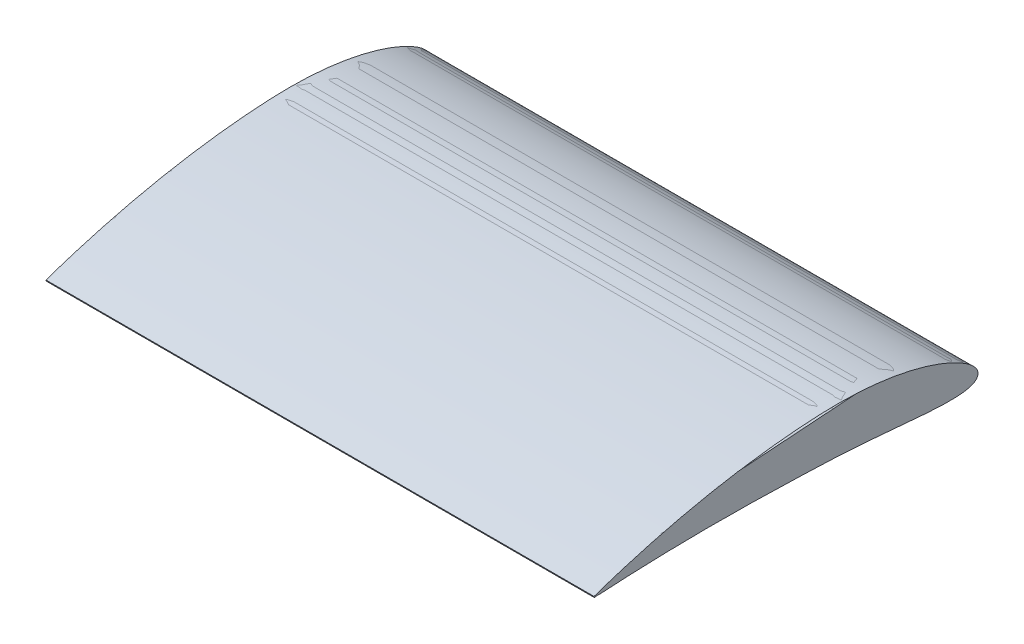
from build123d import *

# Parameters (mm, degrees)
BOSS_EXTRUDE1_DEPTH      = 254
BOSS_EXTRUDE1_DEPTH_BACK = 254


with BuildPart() as part:
    # Sketch1 → Boss-Extrude1 (new, two sides: drawn at the far end of the back side and taken through both)
    with BuildSketch(Plane(origin=(0, 0, 0), x_dir=(0, 0, -1), z_dir=(1, 0, 0)).offset(-BOSS_EXTRUDE1_DEPTH_BACK)):
        with BuildLine():
            Line((-354.886743617, -0.043132144), (-354.99149892, 0.476454159))
            add(Edge.make_bspline(
                [(-354.99149892, 0.476454159), (-347.783593071, 2.959720022), (-333.311697469, 7.76743875), (-304.078052973, 16.464991966), (-267.096515494, 25.774786648), (-229.639462396, 32.944545613), (-199.450230249, 37.301190717), (-176.714275569, 39.827183694), (-153.906158518, 41.58647891), (-131.03977612, 42.479842921), (-108.154229955, 41.863767742), (-89.168120213, 39.979475533), (-74.098856377, 37.594417698), (-62.881435173, 35.331879377), (-51.7773445, 32.562006126), (-40.824113666, 29.240494899), (-31.867581604, 25.954413067), (-24.850887862, 22.951954032), (-19.685642534, 20.484382266), (-14.645467459, 17.767522296), (-9.77578942, 14.742035882), (-5.946772155, 11.874879811), (-3.140632771, 9.269412602), (-1.24439325, 7.100121216), (0.080172615, 5.059059621), (0.734728016, 3.225404373), (0.959702576, 1.749644514), (0.852938138, 0.273348057), (0.143098613, -1.559511436), (-1.577222389, -3.417578203), (-4.142703198, -4.776298794), (-6.885121223, -5.694029747), (-9.681876117, -6.330501065), (-13.458760778, -6.919755633), (-18.220322024, -7.307987073), (-23.94144297, -7.464251794), (-29.662456321, -7.409321836), (-35.379234273, -7.211608771), (-41.090605222, -6.912227315), (-48.699082932, -6.414379812), (-58.199146289, -5.657863194), (-69.590216516, -4.65595538), (-80.978589908, -3.630054837), (-92.368874257, -2.627816782), (-107.56313892, -1.375441372), (-126.573365315, -0.048864739), (-145.613201917, 0.757519293), (-160.850436225, 1.274697119), (-176.087168981, 1.801353096), (-195.136294848, 2.345387362), (-218.000758012, 2.779371126), (-237.05701774, 2.925569666), (-252.302341579, 2.896860798), (-263.73597927, 2.802520029), (-275.168693373, 2.637956293), (-286.600178358, 2.391728354), (-296.124627961, 2.123723762), (-303.742775876, 1.877302738), (-309.456624125, 1.672578754), (-315.170675094, 1.447330006), (-320.881449306, 1.206811952), (-326.586197896, 0.954928725), (-331.352247356, 0.714636978), (-335.168021523, 0.511580202), (-338.020999346, 0.36724993), (-340.852436227, 0.246984365), (-343.684829351, 0.118397327), (-346.099213672, -0.068340914), (-348.057709576, -0.249421829), (-349.49515544, -0.343114156), (-350.641754644, -0.345792204), (-351.509080841, -0.291364997), (-352.169529456, -0.275148661), (-352.878616179, -0.32484418), (-353.534718925, -0.45936157), (-354.133565705, -0.643391605), (-354.471117086, -0.699431405), (-354.718790465, -0.620573956), (-354.877800433, -0.392167923), (-354.878804645, -0.178279335), (-354.886743617, -0.043132144)],
                knots=[-0.000119616, -0.000119616, -0.000119616, -0.000119616, 0.031133862, 0.062387339, 0.124894294, 0.187401249, 0.218654727, 0.249908204, 0.281161682, 0.312415159, 0.343668637, 0.374922115, 0.390548853, 0.406175592, 0.421802331, 0.43742907, 0.453055808, 0.460869178, 0.468682547, 0.476495916, 0.484309286, 0.492122655, 0.49602934, 0.499936025, 0.503842709, 0.505796052, 0.507749394, 0.509702736, 0.511656079, 0.515562763, 0.519469448, 0.523376133, 0.527282817, 0.531189502, 0.539002872, 0.546816241, 0.55462961, 0.56244298, 0.570256349, 0.578069718, 0.593696457, 0.609323196, 0.624949935, 0.640576673, 0.656203412, 0.68745689, 0.718710367, 0.734337106, 0.749963845, 0.781217322, 0.8124708, 0.843724277, 0.859351016, 0.874977755, 0.890604494, 0.906231232, 0.921857971, 0.929671341, 0.93748471, 0.945298079, 0.953111449, 0.960924818, 0.968738187, 0.972644872, 0.976551557, 0.980458242, 0.984364926, 0.988271611, 0.990224953, 0.992178296, 0.994131638, 0.995108309, 0.99608498, 0.997061652, 0.998038323, 0.998526658, 0.999014994, 0.999259162, 0.999503329, 0.999991665, 0.999991665, 0.999991665, 0.999991665], degree=3))
        make_face()
        with BuildLine():
            Line((-354.787327228, -0.030257196), (-354.876173011, 0.410417887))
            add(Edge.make_bspline(
                [(-354.876173011, 0.410417887), (-354.559877309, 0.519388), (-353.29965963, 0.95355787), (-350.47872665, 1.927095868), (-345.800950265, 3.497798274), (-336.024074692, 6.721551148), (-319.654473712, 11.798891927), (-300.598349456, 17.130600639), (-282.422876264, 21.724272526), (-261.175777938, 26.651569731), (-238.622276389, 31.145528798), (-208.774809213, 36.004755717), (-183.96165787, 39.090454058), (-158.902335219, 41.113212891), (-140.096691022, 42.111376668), (-121.516747473, 42.228858195), (-103.422167262, 41.321050632), (-86.188408528, 39.478676181), (-70.043450957, 36.810480574), (-55.199760436, 33.432905997), (-41.843390777, 29.510854383), (-30.130463623, 25.220125297), (-20.187014188, 20.73431935), (-12.107203154, 16.226289935), (-5.926897661, 11.855341958), (-1.679224073, 7.716499794), (0.765838065, 3.796757813), (0.987487677, -0.148325216), (-1.35108726, -3.308943186), (-5.450780885, -5.288085739), (-11.087315968, -6.587464624), (-18.34911979, -7.268527656), (-27.163826626, -7.404874951), (-37.447057223, -7.053797092), (-49.083078017, -6.301866785), (-61.95239395, -5.238034817), (-75.929862643, -3.983911698), (-96.406736552, -2.153555858), (-117.937239158, -0.458414508), (-140.484776897, 0.674535203), (-158.296467959, 1.286744043), (-176.48388462, 1.917893193), (-200.671973719, 2.586246563), (-224.541124114, 2.979106232), (-247.830237405, 3.028480659), (-264.337268621, 2.907447598), (-279.933149694, 2.656365926), (-294.437996632, 2.282890374), (-307.681856469, 1.852126627), (-319.513378006, 1.371074809), (-329.767358246, 0.912902227), (-338.388880463, 0.426846955), (-345.076973543, 0.191518705), (-350.227621538, -0.406394891), (-352.780150329, -0.035387827), (-354.744619464, -0.75811662), (-354.777220059, -0.20251155), (-354.787327228, -0.030257196)],
                knots=[0, 0, 0, 0, 0.001371577, 0.005464776, 0.012234802, 0.021601969, 0.04767125, 0.082496261, 0.102719149, 0.124527079, 0.171912573, 0.19697838, 0.248496767, 0.274385101, 0.300041178, 0.325689988, 0.350525088, 0.374279703, 0.396711254, 0.417576734, 0.436654006, 0.45374439, 0.468679994, 0.481329415, 0.491630702, 0.499615789, 0.505546281, 0.510184984, 0.514824194, 0.520701508, 0.52851604, 0.538465752, 0.550542609, 0.564643256, 0.580638139, 0.598344876, 0.617584458, 0.638174401, 0.682632113, 0.706120665, 0.730727383, 0.755700244, 0.780731769, 0.829932396, 0.853570292, 0.876213105, 0.897609987, 0.917519394, 0.935698347, 0.951942678, 0.966047159, 0.97783994, 0.987174002, 0.993931501, 0.998018399, 0.999385644, 1, 1, 1, 1], degree=3))
        make_face(mode=Mode.SUBTRACT)
    extrude(amount=BOSS_EXTRUDE1_DEPTH + BOSS_EXTRUDE1_DEPTH_BACK)


solid = part.part
